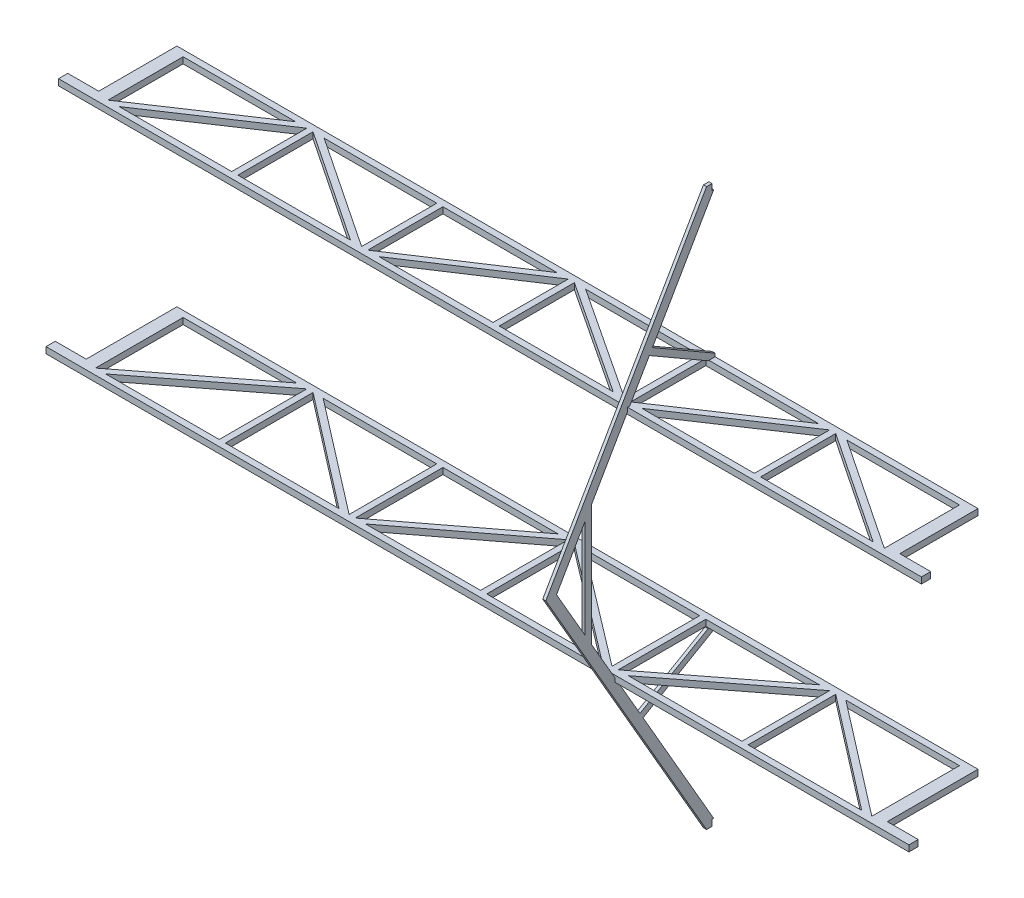
from build123d import *

# Parameters (mm, degrees)
SKETCH_2_W          = 1414.508159515
SKETCH_2_H          = 100
EXTRUDE_2_DEPTH     = 14150
SKETCH_2_W_2        = 1616.580753731
EXTRUDE_2_2_DEPTH   = 14150
CUT_EXTRUDE_1_DEPTH = 1162
CUT_EXTRUDE_2_DEPTH = 1162
CUT_EXTRUDE_3_DEPTH = 1162
CUT_EXTRUDE_4_DEPTH = 1162
EXTRUDE_3_DEPTH     = 50


with BuildPart() as part:
    # Эскиз2 → Бобышка-Вытянуть2 (new body)
    with BuildSketch(Plane.ZY.offset(13650)):
        with Locations((707.254079757, 6500)):
            Rectangle(SKETCH_2_W, SKETCH_2_H)
    extrude(amount=-EXTRUDE_2_DEPTH)

    # Эскиз4 → Вырез-Вытянуть2 (cut)
    with BuildSketch(Plane.XZ.offset(-6450)):
        Polygon((-13550, 2172.390784196), (-13550, 1264.508159515), (-13050, 1264.508159515), (-13050, -667.571915867), (-15150.61658298, -667.571915867), (-15150.61658298, 2172.390784196), align=None)
        Polygon((2000.61658298, -667.571915867), (2000.61658298, 2172.390784196), (400, 2172.390784196), (400, 1264.508159515), (-100, 1264.508159515), (-100, -667.571915867), align=None)
    extrude(amount=-CUT_EXTRUDE_2_DEPTH, mode=Mode.SUBTRACT)

    # Эскиз6 → Вырез-Вытянуть4 (cut)
    with BuildSketch(Plane.XZ.offset(-6450)):
        Polygon((-12850, 1314.508159515), (-12850, 100), (-11030.146798172, 100), align=None)
        Polygon((-12669.853201828, 1314.508159515), (-10850, 100), (-10850, 1314.508159515), align=None)
        Polygon((-8750, 100), (-10569.853201828, 100), (-8750, 1314.508159515), align=None)
        Polygon((-8930.146798172, 1314.508159515), (-10750, 1314.508159515), (-10750, 100), align=None)
        Polygon((-8650, 1314.508159515), (-8650, 100), (-6806.75217409, 100), align=None)
        Polygon((-8468.24782591, 1314.508159515), (-6625, 100), (-6625, 1314.508159515), align=None)
        Polygon((-4681.75217409, 1314.508159515), (-6525, 1314.508159515), (-6525, 100), align=None)
        Polygon((-6343.24782591, 100), (-4500, 1314.508159515), (-4500, 100), align=None)
        Polygon((-4400, 1314.508159515), (-4400, 100), (-2580.146798172, 100), align=None)
        Polygon((-4219.853201828, 1314.508159515), (-2400, 100), (-2400, 1314.508159515), align=None)
        Polygon((-480.146798172, 1314.508159515), (-2300, 1314.508159515), (-2300, 100), align=None)
        Polygon((-300, 100), (-2119.853201828, 100), (-300, 1314.508159515), align=None)
    extrude(amount=-CUT_EXTRUDE_4_DEPTH, mode=Mode.SUBTRACT)


with BuildPart() as body_2:
    # Эскиз2 → Extrude 2 2 (new body)
    with BuildSketch(Plane.ZY.offset(13650)):
        with Locations((808.290376866, 2850)):
            Rectangle(SKETCH_2_W_2, SKETCH_2_H)
    extrude(amount=-EXTRUDE_2_2_DEPTH)

    # Эскиз3 → Вырез-Вытянуть1 (cut)
    with BuildSketch(Plane.XZ.offset(-2800)):
        Polygon((-13550, 2005.004538192), (-13550, 1466.580753731), (-13050, 1466.580753731), (-13050, -834.958161872), (-14812.735944929, -834.958161872), (-14812.735944929, 2005.004538192), align=None)
        Polygon((1662.735944929, -834.958161872), (1662.735944929, 2005.004538192), (400, 2005.004538192), (400, 1466.580753731), (-100, 1466.580753731), (-100, -834.958161872), align=None)
    extrude(amount=-CUT_EXTRUDE_1_DEPTH, mode=Mode.SUBTRACT)

    # Эскиз5 → Вырез-Вытянуть3 (cut)
    with BuildSketch(Plane.XZ.offset(-2800)):
        Polygon((-12850, 1516.580753731), (-12850, 100), (-11013.717347698, 100), align=None)
        Polygon((-12686.282652302, 1516.580753731), (-10850, 100), (-10850, 1516.580753731), align=None)
        Polygon((-8750, 100), (-10586.282652302, 100), (-8750, 1516.580753731), align=None)
        Polygon((-8913.717347698, 1516.580753731), (-10750, 1516.580753731), (-10750, 100), align=None)
        Polygon((-8650, 1516.580753731), (-8650, 100), (-6790.043709488, 100), align=None)
        Polygon((-8484.956290512, 1516.580753731), (-6625, 100), (-6625, 1516.580753731), align=None)
        Polygon((-4665.043709488, 1516.580753731), (-6525, 1516.580753731), (-6525, 100), align=None)
        Polygon((-6359.956290512, 100), (-4500, 1516.580753731), (-4500, 100), align=None)
        Polygon((-4400, 1516.580753731), (-4400, 100), (-2563.717347698, 100), align=None)
        Polygon((-4236.282652302, 1516.580753731), (-2400, 100), (-2400, 1516.580753731), align=None)
        Polygon((-463.717347698, 1516.580753731), (-2300, 1516.580753731), (-2300, 100), align=None)
        Polygon((-300, 100), (-2136.282652302, 100), (-300, 1516.580753731), align=None)
    extrude(amount=-CUT_EXTRUDE_3_DEPTH, mode=Mode.SUBTRACT)


with BuildPart() as body_3:
    # Эскиз7 → Бобышка-Вытянуть3 (new body)
    with BuildSketch(Plane(origin=(-4400, 0, 0), x_dir=(0, 0, -1), z_dir=(1, 0, 0))):
        Polygon((-2736.640275959, 4500), (-138.564064605, 9000), (-50, 9000), (-50, 8900), (-23.094010768, 8900), (-1013.249722428, 7185), (0, 6600), (0, 6550), (-113.397459622, 6550), (-1063.249722428, 7098.397459622), (-2000, 5475.898384862), (-2000, 3524.101615138), (-1214.80416809, 2164.102540378), (-113.397459622, 2800), (0, 2800), (0, 2750), (-1164.80416809, 2077.5), (-23.094010768, 100), (-50, 100), (-50, 0), (-138.564064605, 0), align=None)
        Polygon((-2100, 5302.693304105), (-2100, 3697.306695895), (-2563.435195202, 4500), align=None, mode=Mode.SUBTRACT)
    extrude(amount=EXTRUDE_3_DEPTH)


solid = Compound([part.part, body_2.part, body_3.part])
